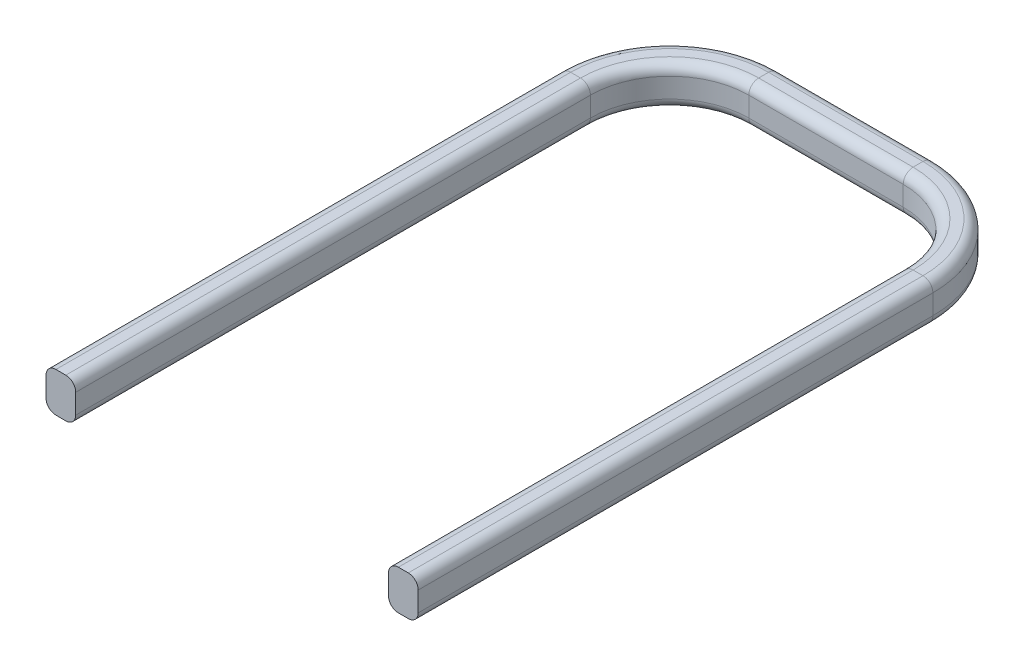
from build123d import *

# Parameters (mm, degrees)
SKETCH2_W    = 0.75
SKETCH2_H    = 1
FILLET1_R    = 0.25
SCALE1_SCALE = 0.445


with BuildPart() as part:
    # Sweep1: sweep along a path in Sketch1
    with BuildLine(Plane(origin=(0, 0, 0), x_dir=(1, 0, 0), z_dir=(0, 1, 0))) as sweep1_path:
        Line((-3.95, 0), (-3.95, 13))
        ThreePointArc((-3.95, 13), (-3.364213562, 14.414213562), (-1.95, 15))
        Line((-1.95, 15), (1.95, 15))
        ThreePointArc((1.95, 15), (3.364213562, 14.414213562), (3.95, 13))
        Line((3.95, 13), (3.95, 0))
    # Sketch2 → Sweep1 (sweep)
    with BuildSketch(Plane.XY):
        with Locations((-4.325, 0.5)):
            Rectangle(SKETCH2_W, SKETCH2_H)
    sweep(path=sweep1_path.line)

    # Fillet1
    fillet1_edges = [part.edges().sort_by_distance(p)[0] for p in [
        (3.95, 1, -6.5),
        (4.7, 1, -6.5),
        (4.7, 0, -6.5),
        (-3.95, 0, -6.5),
        (-3.95, 1, -6.5),
        (-4.7, 1, -6.5),
        (-4.7, 0, -6.5),
        (-3.364213562, 0, -14.414213562),
        (-3.364213562, 1, -14.414213562),
        (-3.894543648, 1, -14.944543648),
        (-3.894543648, 0, -14.944543648),
        (0, 0, -15),
        (0, 1, -15),
        (0, 1, -15.75),
        (0, 0, -15.75),
        (3.364213562, 0, -14.414213562),
        (3.364213562, 1, -14.414213562),
        (3.894543648, 1, -14.944543648),
        (3.894543648, 0, -14.944543648),
        (3.95, 0, -6.5),
    ]]
    fillet(fillet1_edges, radius=FILLET1_R)


with BuildPart() as part_1:
    # Scale1: scaled about (0, 0, 0)
    add(part.part.scale(SCALE1_SCALE))


solid = part_1.part
